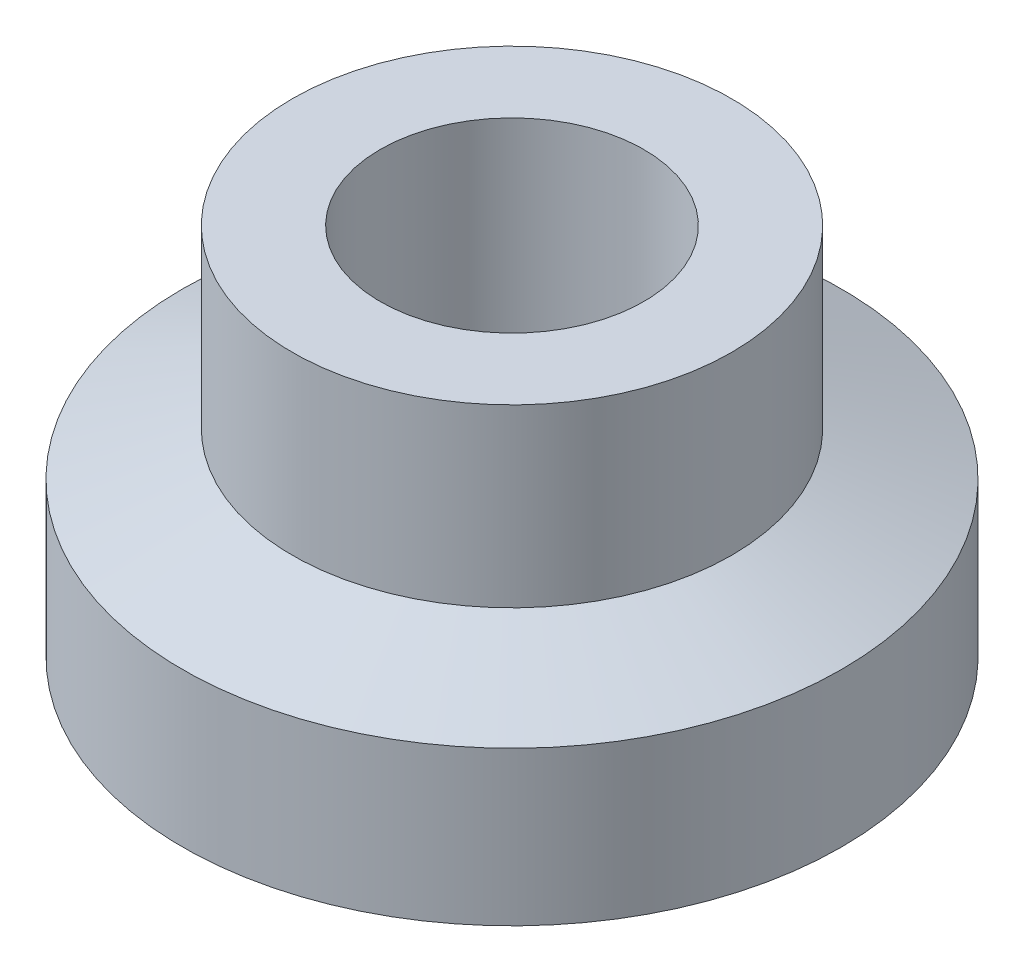
from build123d import *

# Parameters (mm, degrees)
M4_TAPPED_HOLE1_D     = 3.3
M4_TAPPED_HOLE1_DEPTH = 10.508579979
M4_TAPPED_HOLE1_TIP   = 0.991420021


with BuildPart() as part:
    # Sketch1 → Revolve1 (revolve)
    with BuildSketch(Plane.XY, mode=Mode.PRIVATE) as revolve1_sk:
        Polygon((0, 0), (15, 0), (15, 7), (10, 9), (10, 17), (6, 17), (6, 5), (0, 5), align=None)
    revolve(revolve1_sk.sketch.rotate(Axis((0, 5, 0), (0, -1, 0)), 180), axis=Axis((0, 5, 0), (0, -1, 0)))

    # M4 Tapped Hole1
    with Locations(Plane(origin=(0, 0, 0), x_dir=(-1, 0, 0), z_dir=(0, -1, 0))):
        with Locations((0, 0)):
            Hole(M4_TAPPED_HOLE1_D / 2, depth=M4_TAPPED_HOLE1_DEPTH)
            with Locations((0, 0, -(M4_TAPPED_HOLE1_DEPTH + M4_TAPPED_HOLE1_TIP / 2))):  # 118° drill point
                Cone(0, M4_TAPPED_HOLE1_D / 2, M4_TAPPED_HOLE1_TIP, mode=Mode.SUBTRACT)


solid = part.part
